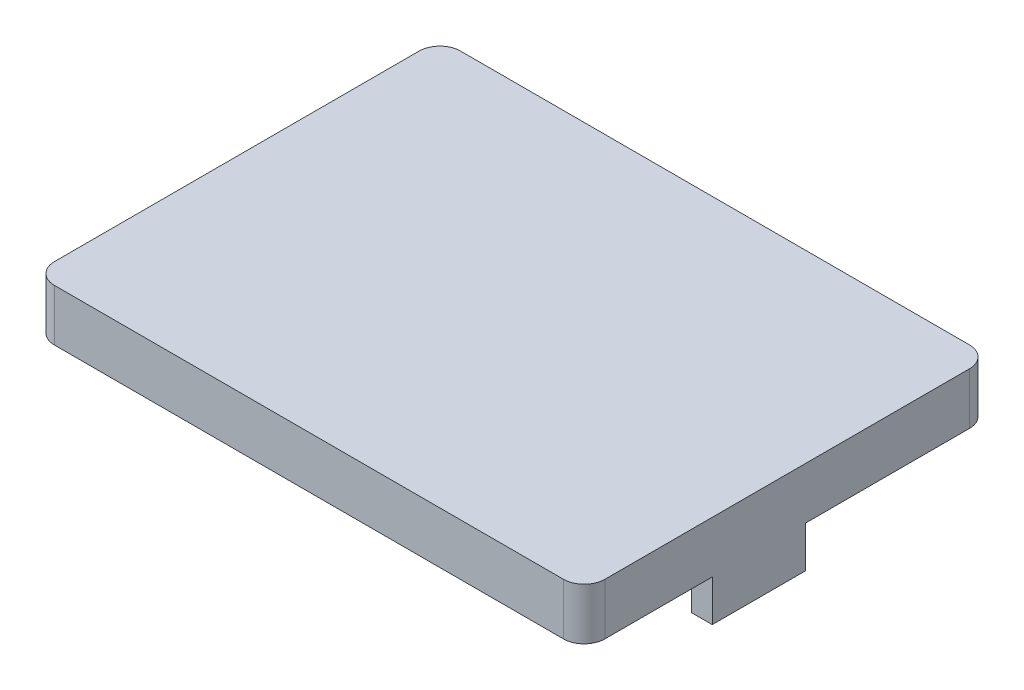
from build123d import *

# Parameters (mm, degrees)
SKETCH1_W           = 53.26
SKETCH1_H           = 39.29
BOSS_EXTRUDE1_DEPTH = 5
FILLET1_R           = 2
SKETCH2_R           = 2.55
CUT_EXTRUDE1_DEPTH  = 4.1
SKETCH3_W           = 2
SKETCH3_H           = 9
BOSS_EXTRUDE2_DEPTH = 4


with BuildPart() as part:
    # Sketch1 → Boss-Extrude1 (new body)
    with BuildSketch(Plane(origin=(0, 0, 0), x_dir=(1, 0, 0), z_dir=(0, 1, 0))):
        Rectangle(SKETCH1_W, SKETCH1_H)
    extrude(amount=BOSS_EXTRUDE1_DEPTH)

    # Fillet1
    fillet1_edges = [part.edges().sort_by_distance(p)[0] for p in [
        (26.63, 2.5, 19.645),
        (-26.63, 2.5, 19.645),
        (-26.63, 2.5, -19.645),
        (26.63, 2.5, -19.645),
    ]]
    fillet(fillet1_edges, radius=FILLET1_R)

    # Sketch2 → Cut-Extrude1 (cut)
    with BuildSketch(Plane(origin=(0, 0, 0), x_dir=(-1, 0, 0), z_dir=(0, -1, 0))):
        with Locations(Location((23.03, -16.045, 0), (0, 0, 90))):
            Circle(SKETCH2_R)
        with Locations(Location((23.03, 16.045, 0), (0, 0, 90))):
            Circle(SKETCH2_R)
    extrude(amount=-CUT_EXTRUDE1_DEPTH, mode=Mode.SUBTRACT)

    # Sketch3 → Boss-Extrude2 (add)
    with BuildSketch(Plane(origin=(0, 0, 0), x_dir=(-1, 0, 0), z_dir=(0, -1, 0))):
        with Locations((-25.63, -2.748)):
            Rectangle(SKETCH3_W, SKETCH3_H)
    extrude(amount=BOSS_EXTRUDE2_DEPTH)


solid = part.part
